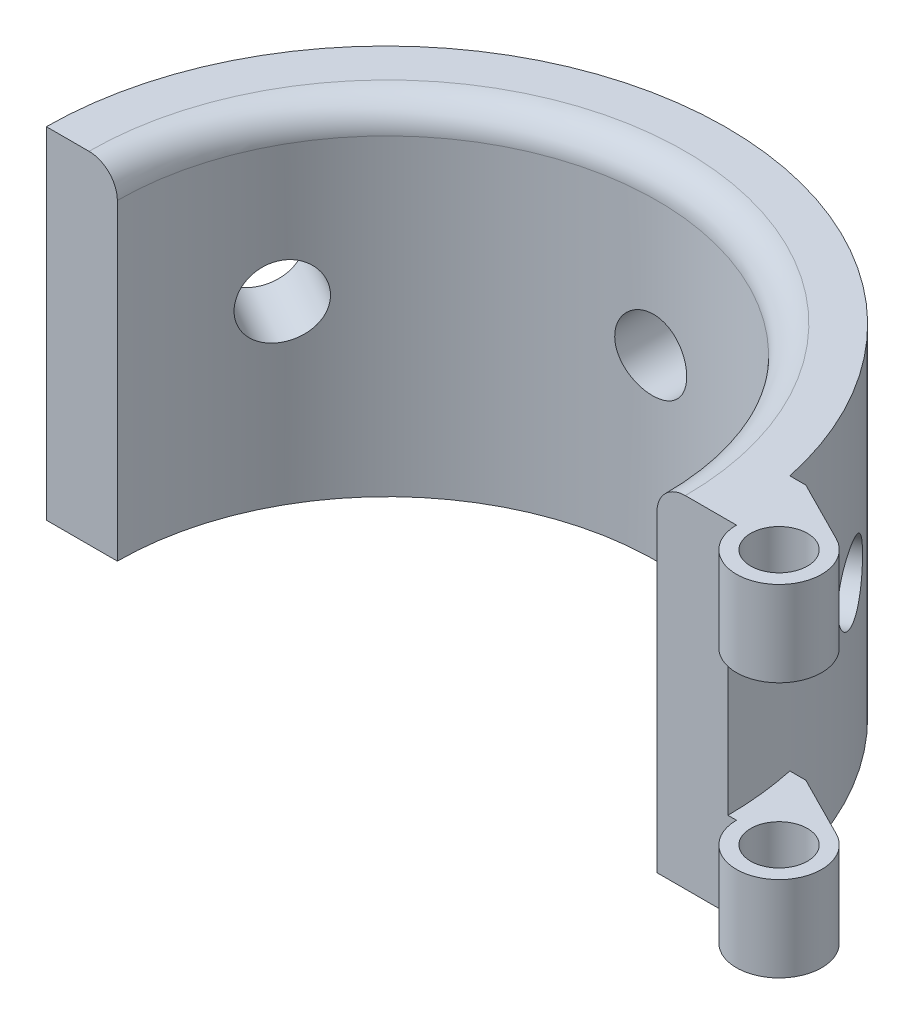
from build123d import *

# Parameters (mm, degrees)
BOSS_EXTRUDE1_DEPTH = 30.48
SKETCH3_R           = 24.13
CUT_EXTRUDE4_DEPTH  = 90.914560616
SKETCH4_R           = 3.175
CUT_EXTRUDE5_DEPTH  = 63.754
CIRPATTERN3_COUNT   = 6
BOSS_EXTRUDE2_START = -7.62
BOSS_EXTRUDE2_DEPTH = 7.62
LPATTERN1_COUNT     = 2
LPATTERN1_PITCH     = 22.86
FILLET1_R           = 2.54


with BuildPart() as part:
    # Sketch1 → Boss-Extrude1 (new body)
    with BuildSketch(Plane(origin=(0, 0, 0), x_dir=(1, 0, 0), z_dir=(0, 1, 0))):
        with BuildLine():
            Line((-78.958715675, 0), (-17.998715675, 0))
            ThreePointArc((-17.998715675, 0), (-48.478715675, 30.349942827), (-78.958715675, 0))
        make_face()
    extrude(amount=BOSS_EXTRUDE1_DEPTH)

    # Sketch3 → Cut-Extrude4 (cut, through all)
    with BuildSketch(Plane(origin=(0, 0, 0), x_dir=(1, 0, 0), z_dir=(0, 1, 0))):
        with Locations((-48.478715675, 0)):
            Circle(SKETCH3_R)
    extrude(amount=CUT_EXTRUDE4_DEPTH, mode=Mode.SUBTRACT)

    # Sketch4 → Cut-Extrude5 (cut)
    with BuildSketch(Plane.XY):
        with Locations((-48.824364134, 15.798935299)):
            Circle(SKETCH4_R)
    cut_extrude5 = extrude(amount=-CUT_EXTRUDE5_DEPTH, mode=Mode.SUBTRACT)

    # CirPattern3: Cut-Extrude5 ×6 about axis
    cirpattern3_axis = Axis((-48.478715675, 30.48, 0.130335837), (0, -1, 0))
    for i in range(1, CIRPATTERN3_COUNT):
        add(cut_extrude5.rotate(cirpattern3_axis, i * 360 / CIRPATTERN3_COUNT), mode=Mode.SUBTRACT)

    # Sketch5 → Boss-Extrude2 (add)
    with BuildSketch(Plane(origin=(0, 30.48, 0), x_dir=(1, 0, 0), z_dir=(0, 1, 0)).offset(BOSS_EXTRUDE2_START)):
        with BuildLine():
            Line((-17.998715675, 0), (-17.236715675, 0))
            ThreePointArc((-17.236715675, 0), (-11.432288754, -3.246284223), (-11.704767509, 3.398675405))
            Line((-11.704767509, 3.398675405), (-17.236715675, 6.201452036))
            Line((-17.236715675, 6.201452036), (-18.252715675, 6.201452036))
            Line((-18.252715675, 6.201452036), (-18.663353029, 6.201452036))
            ThreePointArc((-18.663353029, 6.201452036), (-18.171997096, 3.117770752), (-17.998715675, 0))
        make_face()
        with BuildLine():
            ThreePointArc((-10.886715675, 0), (-13.426715675, -2.54), (-15.966715675, 0))
            ThreePointArc((-15.966715675, 0), (-13.426715675, 2.54), (-10.886715675, 0))
        make_face(mode=Mode.SUBTRACT)
    boss_extrude2 = extrude(amount=BOSS_EXTRUDE2_DEPTH)

    # LPattern1: Boss-Extrude2 ×2
    with Locations(*[(0, -i * LPATTERN1_PITCH, 0) for i in range(1, LPATTERN1_COUNT)]):
        add(boss_extrude2)

    # Fillet1
    fillet1_edges = [part.edges().sort_by_distance(p)[0] for p in [
        (-48.478715675, 30.48, -24.13),
    ]]
    fillet(fillet1_edges, radius=FILLET1_R)


solid = part.part
